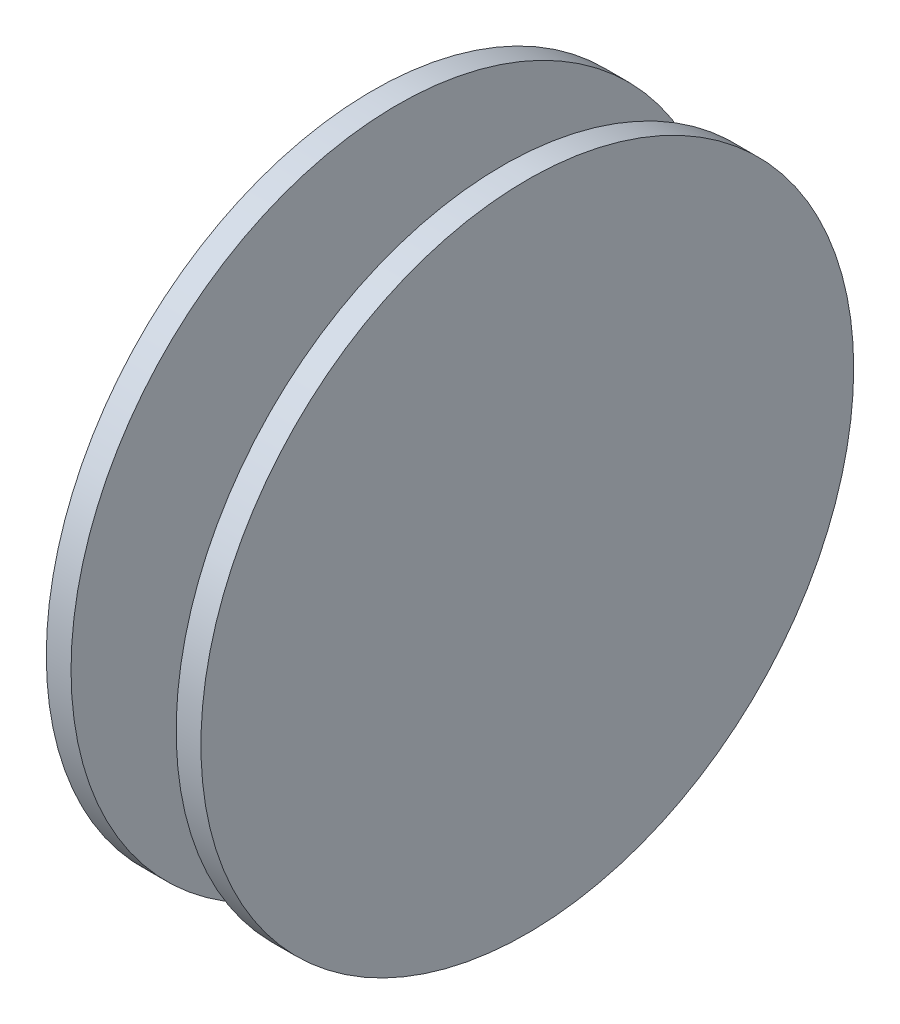
from build123d import *

# Parameters (mm, degrees)
SKETCH4_R           = 83.82
BOSS_EXTRUDE1_DEPTH = 6.35
SKETCH5_R           = 5
BOSS_EXTRUDE4_DEPTH = 27
BOSS_EXTRUDE5_START = 6.35
SKETCH7_R           = 83.82
BOSS_EXTRUDE5_DEPTH = 6.35


with BuildPart() as part:
    # Sketch4 → Boss-Extrude1 (new body)
    with BuildSketch(Plane(origin=(0, 0, 0), x_dir=(0, 0, -1), z_dir=(1, 0, 0))):
        Circle(SKETCH4_R)
    extrude(amount=BOSS_EXTRUDE1_DEPTH)

    # Sketch5 → Boss-Extrude4 (add)
    with BuildSketch(Plane.ZY):
        with Locations(Location((0, 0, 0), (0, 0, 180))):
            Circle(SKETCH5_R)
    extrude(amount=BOSS_EXTRUDE4_DEPTH)

    # Sketch7 → Boss-Extrude5 (add)
    with BuildSketch(Plane.ZY.offset(27).offset(BOSS_EXTRUDE5_START)):
        with Locations(Location((0, 0, 0), (0, 0, 180))):
            Circle(SKETCH7_R)
    extrude(amount=-BOSS_EXTRUDE5_DEPTH)


solid = part.part
